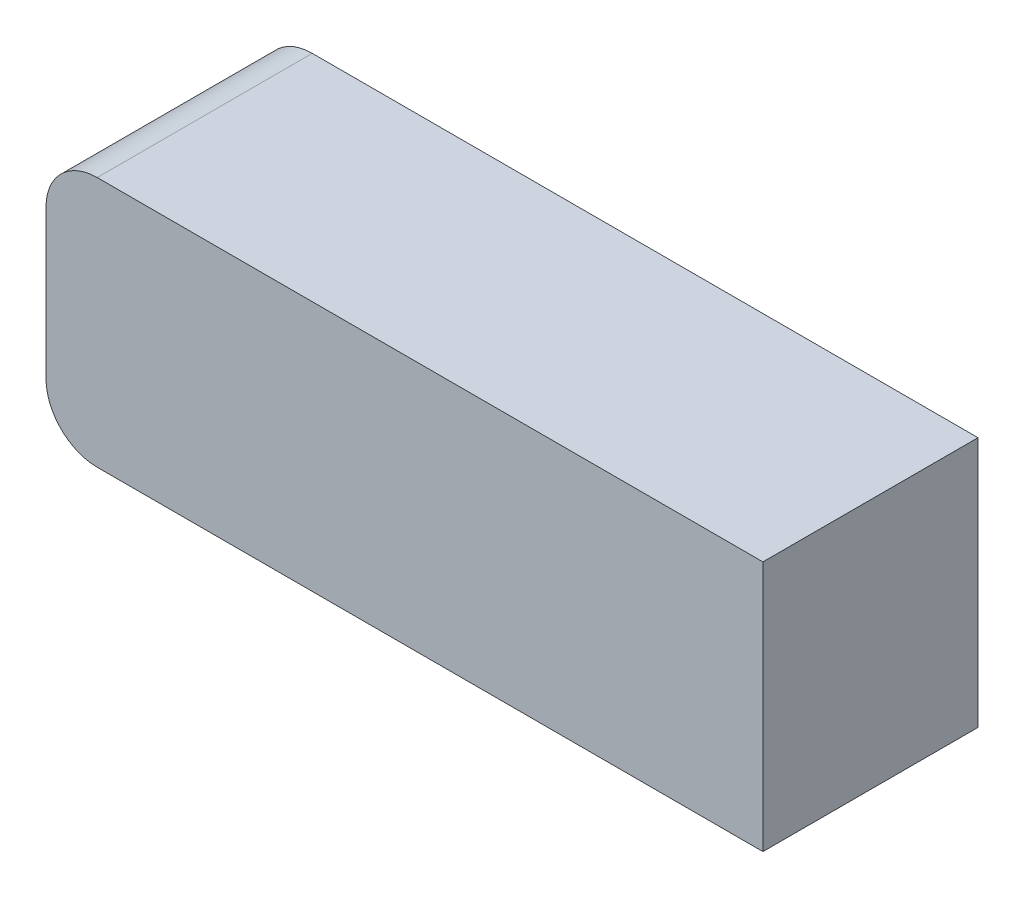
from build123d import *

# Parameters (mm, degrees)
CROQUIS2_W              = 140
CROQUIS2_H              = 42
SALIENTE_EXTRUIR1_DEPTH = 24.5
REDONDEO1_R             = 10


with BuildPart() as part:
    # Croquis2 → Saliente-Extruir1 (new, symmetric)
    with BuildSketch(Plane(origin=(0, 0, 0), x_dir=(1, 0, 0), z_dir=(0, 1, 0))):
        Rectangle(CROQUIS2_W, CROQUIS2_H)
    extrude(amount=SALIENTE_EXTRUIR1_DEPTH, both=True)

    # Redondeo1
    redondeo1_edges = [part.edges().sort_by_distance(p)[0] for p in [
        (-70, 24.5, 0),
        (-70, -24.5, 0),
    ]]
    fillet(redondeo1_edges, radius=REDONDEO1_R)


solid = part.part
